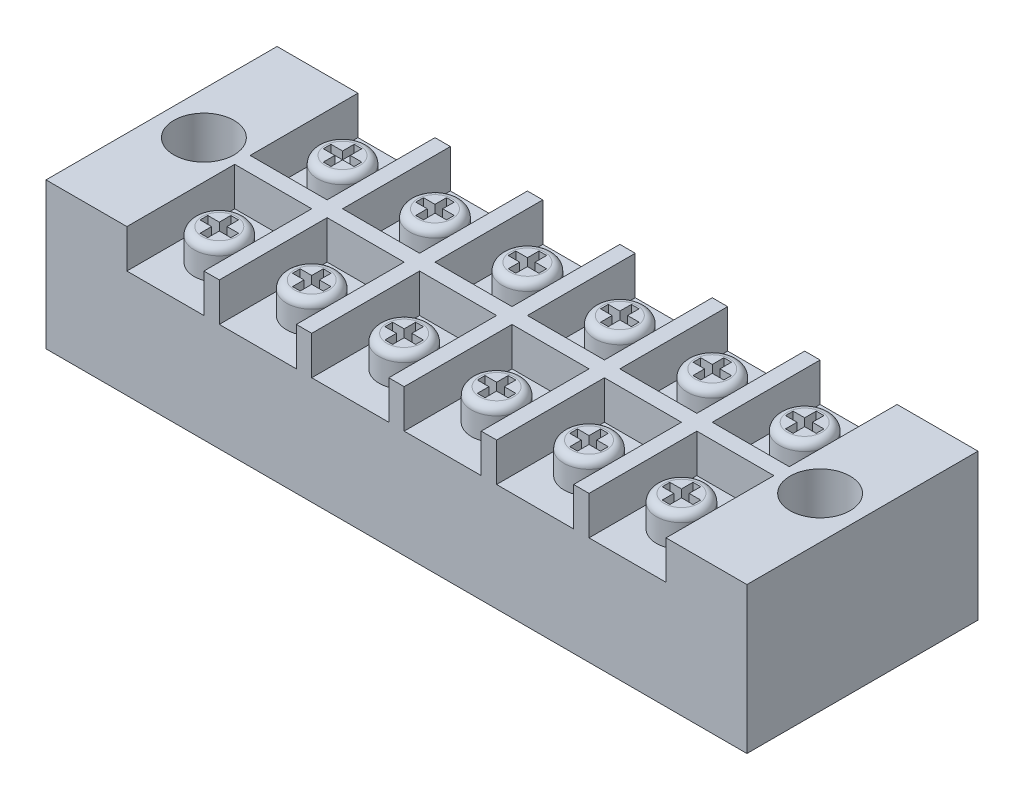
from build123d import *

# Parameters (mm, degrees)
SKETCH_1_W                     = 91
SKETCH_1_H                     = 30
EXTRUDE_1_DEPTH                = 19
SKETCH_2_R                     = 2.15
CUT_EXTRUDE_1_DEPTH            = 52.53882032
SKETCH_3_W                     = 10
SKETCH_3_H                     = 14
CUT_EXTRUDE_2_DEPTH            = 5
SKETCH_4_R                     = 3.9
CUT_EXTRUDE_3_DEPTH            = 13.6
SKETCH_5_R                     = 3.25
EXTRUDE_2_DEPTH                = 4
FILLET_1_R                     = 1
EXTRUDE_3_DEPTH                = 3
PATTERN_LINEAR_1_COUNT         = 6
PATTERN_LINEAR_1_PITCH         = 12
PATTERN_LINEAR_1_COUNT_DIR2    = 2
PATTERN_LINEAR_1_PITCH_DIR2    = 16
FILLET_1_OF_PATTERN_LINEAR_1_R = 1


with BuildPart() as part:
    # 草图1 → 凸台-拉伸1 (new body)
    with BuildSketch(Plane(origin=(0, 0, 0), x_dir=(1, 0, 0), z_dir=(0, 1, 0))):
        Rectangle(SKETCH_1_W, SKETCH_1_H)
    extrude(amount=EXTRUDE_1_DEPTH)

    # 草图2 → 切除-拉伸1 (cut, through all)
    with BuildSketch(Plane(origin=(0, 19, 0), x_dir=(1, 0, 0), z_dir=(0, 1, 0))):
        with Locations(Location((-40, 0, 0), (0, 0, 270))):
            Circle(SKETCH_2_R)
        with Locations(Location((40, 0, 0), (0, 0, 90))):
            Circle(SKETCH_2_R)
    extrude(amount=-CUT_EXTRUDE_1_DEPTH, mode=Mode.SUBTRACT)

    # 草图3 → 切除-拉伸2 (cut)
    with BuildSketch(Plane(origin=(0, 19, 0), x_dir=(1, 0, 0), z_dir=(0, 1, 0))):
        with Locations((-30, 8)):
            Rectangle(SKETCH_3_W, SKETCH_3_H)
        with Locations((-18, 8)):
            Rectangle(SKETCH_3_W, SKETCH_3_H)
        with Locations((-6, 8)):
            Rectangle(SKETCH_3_W, SKETCH_3_H)
        with Locations((-6, -8)):
            Rectangle(SKETCH_3_W, SKETCH_3_H)
        with Locations((-18, -8)):
            Rectangle(SKETCH_3_W, SKETCH_3_H)
        with Locations((-30, -8)):
            Rectangle(SKETCH_3_W, SKETCH_3_H)
        with Locations((30, -8)):
            Rectangle(SKETCH_3_W, SKETCH_3_H)
        with Locations((18, -8)):
            Rectangle(SKETCH_3_W, SKETCH_3_H)
        with Locations((6, -8)):
            Rectangle(SKETCH_3_W, SKETCH_3_H)
        with Locations((6, 8)):
            Rectangle(SKETCH_3_W, SKETCH_3_H)
        with Locations((18, 8)):
            Rectangle(SKETCH_3_W, SKETCH_3_H)
        with Locations((30, 8)):
            Rectangle(SKETCH_3_W, SKETCH_3_H)
    extrude(amount=-CUT_EXTRUDE_2_DEPTH, mode=Mode.SUBTRACT)

    # 草图4 → 切除-拉伸3 (cut)
    with BuildSketch(Plane(origin=(0, 19, 0), x_dir=(1, 0, 0), z_dir=(0, 1, 0))):
        with Locations(Location((-40, 0, 0), (0, 0, 270))):
            Circle(SKETCH_4_R)
        with Locations(Location((40, 0, 0), (0, 0, 90))):
            Circle(SKETCH_4_R)
    extrude(amount=-CUT_EXTRUDE_3_DEPTH, mode=Mode.SUBTRACT)

    # 草图5 → 凸台-拉伸2 (add)
    with BuildSketch(Plane(origin=(0, 14, 0), x_dir=(1, 0, 0), z_dir=(0, 1, 0))):
        with Locations(Location((-30, 8, 0), (0, 0, 270))):
            Circle(SKETCH_5_R)
        Polygon((-29.5, 6), (-30.5, 6), (-30.5, 7.5), (-32, 7.5), (-32, 8.5), (-30.5, 8.5), (-30.5, 10), (-29.5, 10), (-29.5, 8.5), (-28, 8.5), (-28, 7.5), (-29.5, 7.5), align=None, mode=Mode.SUBTRACT)
    extrude_2 = extrude(amount=EXTRUDE_2_DEPTH)

    # 圆角1
    fillet_1_edges = [part.edges().sort_by_distance(p)[0] for p in [
        (-30, 18, -11.25),
    ]]
    fillet(fillet_1_edges, radius=FILLET_1_R)

    # 草图6 → 凸台-拉伸3 (add)
    with BuildSketch(Plane(origin=(0, 14, 0), x_dir=(1, 0, 0), z_dir=(0, 1, 0))):
        Polygon((-28, 8.5), (-29.5, 8.5), (-29.5, 10), (-30.5, 10), (-30.5, 8.5), (-32, 8.5), (-32, 7.5), (-30.5, 7.5), (-30.5, 6), (-29.5, 6), (-29.5, 7.5), (-28, 7.5), align=None)
    extrude(amount=EXTRUDE_3_DEPTH)

    # 阵列(线性)1: Extrude 2 6 × 2
    with Locations(*[(i * PATTERN_LINEAR_1_PITCH, 0, j * PATTERN_LINEAR_1_PITCH_DIR2) for i in range(PATTERN_LINEAR_1_COUNT) for j in range(PATTERN_LINEAR_1_COUNT_DIR2) if (i, j) != (0, 0)]):
        add(extrude_2)

    # 圆角1 of 阵列(线性)1
    fillet_1_of_pattern_linear_1_edges = [part.edges().sort_by_distance(p)[0] for p in [
        (-30, 18, 4.75),
        (-18, 18, -11.25),
        (-18, 18, 4.75),
        (-6, 18, -11.25),
        (-6, 18, 4.75),
        (6, 18, -11.25),
        (6, 18, 4.75),
        (18, 18, -11.25),
        (18, 18, 4.75),
        (30, 18, -11.25),
        (30, 18, 4.75),
    ]]
    fillet(fillet_1_of_pattern_linear_1_edges, radius=FILLET_1_OF_PATTERN_LINEAR_1_R)


solid = part.part
